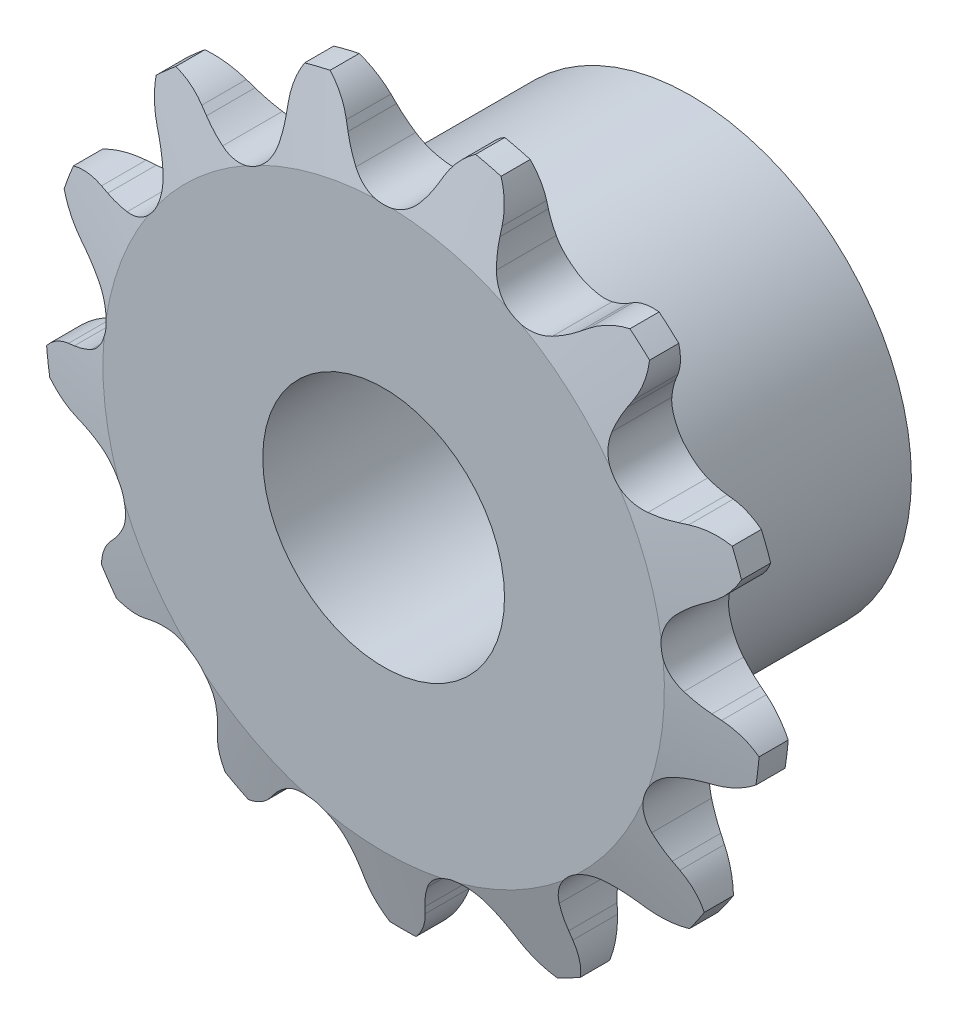
from build123d import *

# Parameters (mm, degrees)
TOOTH_CUT_NUMBER_OF_TEETH_13_DEPTH = 21.957854648
TOOTH_PATTERN_13_13_COUNT          = 13
SKETCH3_W                          = 9.906
SKETCH3_H                          = 9.12876
CUT_EXTRUDE1_DEPTH                 = 24.738017509
CUT_EXTRUDE1_DEPTH_BACK            = 24.738017509
SKETCH4_R                          = 5


with BuildPart() as part:
    # Sprocket-BaseSketch → 25 (04C) ANSI (ISO) Chain Number, 1.045in P.D. (revolve)
    with BuildSketch(Plane(origin=(0, 0, 0), x_dir=(0, 0, -1), z_dir=(1, 0, 0))):
        Polygon((1.397, 0), (1.397, 11.611481367), (0.60325, 14.786481367), (-0.60325, 14.786481367), (-1.397, 11.611481367), (-1.397, 0), align=None)
    revolve(axis=Axis((0, 0, -5.588), (0, 0, 1)))

    # Tooth-Sketch → Tooth-Cut, Number of teeth: 13 (cut, symmetric)
    with BuildSketch(Plane.XY):
        with BuildLine():
            Line((1.867441472, 13.054526629), (2.01691529, 13.362040532))
            ThreePointArc((2.01691529, 13.362040532), (3.030656136, 14.490196176), (4.488469834, 14.908747111))
            ThreePointArc((4.488469834, 14.908747111), (0, 15.569749576), (-4.488469834, 14.908747111))
            ThreePointArc((-4.488469834, 14.908747111), (-3.030656136, 14.490196176), (-2.01691529, 13.362040532))
            Line((-2.01691529, 13.362040532), (-1.867441472, 13.054526629))
            ThreePointArc((-1.867441472, 13.054526629), (-1.613506806, 12.602873257), (-1.307543945, 12.184710237))
            ThreePointArc((-1.307543945, 12.184710237), (0, 11.569641164), (1.307543945, 12.184710237))
            ThreePointArc((1.307543945, 12.184710237), (1.613506806, 12.602873257), (1.867441472, 13.054526629))
        make_face()
    tooth_cut_number_of_teeth_13 = extrude(amount=TOOTH_CUT_NUMBER_OF_TEETH_13_DEPTH, both=True, mode=Mode.SUBTRACT)

    # Tooth Pattern, 13 / 13: Tooth-Cut, Number of teeth: 13 ×13 about axis
    tooth_pattern_13_13_axis = Axis((0, 0, -88.99), (0, 0, 1))
    for i in range(1, TOOTH_PATTERN_13_13_COUNT):
        add(tooth_cut_number_of_teeth_13.rotate(tooth_pattern_13_13_axis, i * 360 / TOOTH_PATTERN_13_13_COUNT), mode=Mode.SUBTRACT)

    # Sketch3 → Hub-Revolve1 (revolve)
    with BuildSketch(Plane(origin=(0, 0, 0), x_dir=(0, 0, -1), z_dir=(1, 0, 0))):
        with Locations((6.35, 4.56438)):
            Rectangle(SKETCH3_W, SKETCH3_H)
    revolve(axis=Axis((0, 0, 9.906), (0, 0, -1)))

    # Sketch4 → Cut-Extrude1 (cut, two sides: drawn at the far end of the back side and taken through both)
    with BuildSketch(Plane.XY.offset(-CUT_EXTRUDE1_DEPTH_BACK)):
        Circle(SKETCH4_R)
    extrude(amount=CUT_EXTRUDE1_DEPTH + CUT_EXTRUDE1_DEPTH_BACK, mode=Mode.SUBTRACT)


solid = part.part
